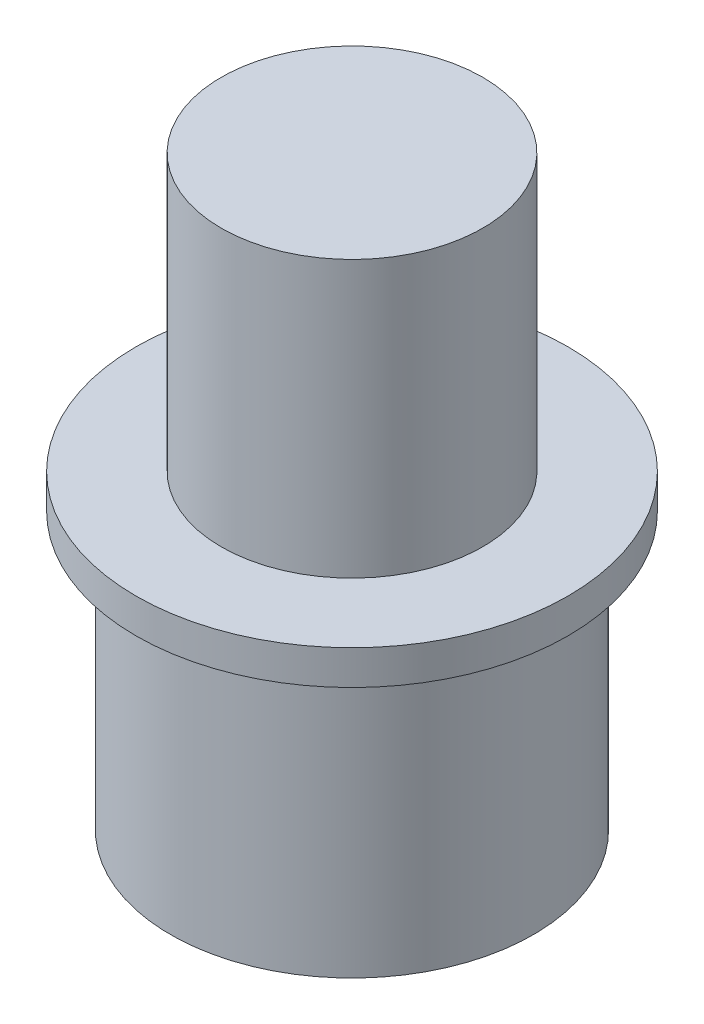
from build123d import *


with BuildPart() as part:
    # Sketch2 → Revolve2 (revolve)
    with BuildSketch(Plane.XY, mode=Mode.PRIVATE) as revolve2_sk:
        Polygon((0, 21.59), (0, 8.89), (3.175, 8.89), (3.175, 0), (4.7625, 0), (6.6802, 0), (6.6802, 10.16), (7.9502, 10.16), (7.9502, 11.43), (4.8133, 11.43), (4.8133, 21.59), align=None)
    revolve(revolve2_sk.sketch.rotate(Axis((0, 0, 0), (0, 1, 0)), 90), axis=Axis((0, 0, 0), (0, 1, 0)))


solid = part.part
